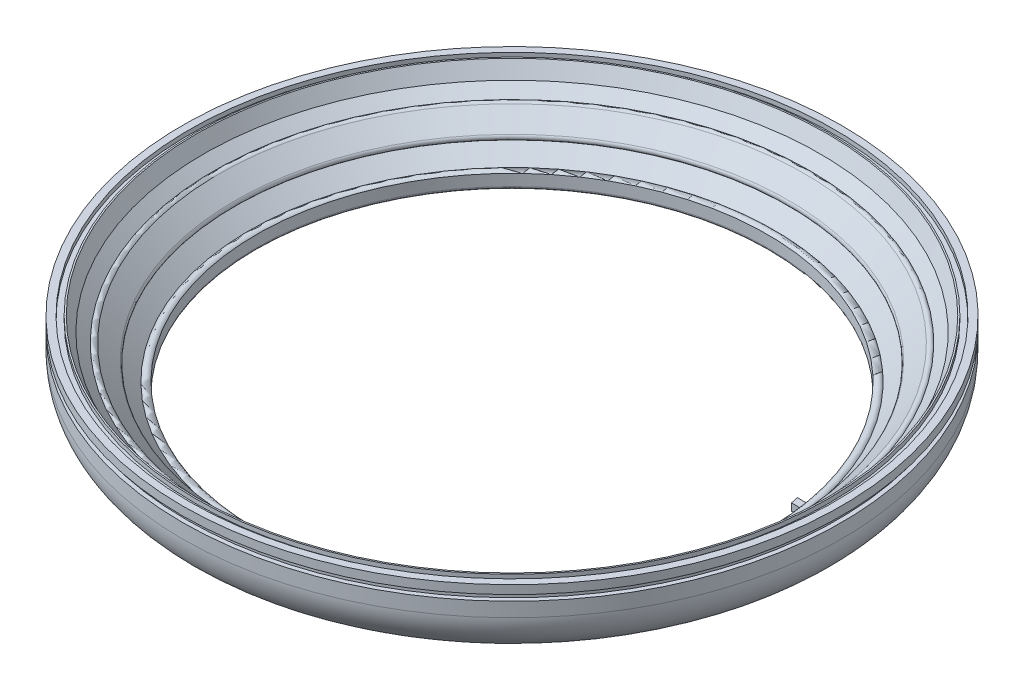
from build123d import *

# Parameters (mm, degrees)
FILLET1_R               = 3
FILLET2_R               = 0.2
SKETCH2_W               = 3.548736527
SKETCH2_H               = 0.52
BOSS_EXTRUDE2_DEPTH     = 0.5
CUT_EXTRUDE3_DEPTH      = 33.9212261
CUT_EXTRUDE3_DEPTH_BACK = 33.9212261


with BuildPart() as part:
    # Sketch1 → Revolve1 (revolve)
    with BuildSketch(Plane.XY, mode=Mode.PRIVATE) as revolve1_sk:
        with BuildLine():
            Line((-23.009126928, -0.003272675), (-23.009126928, 3.996727325))
            Line((-23.009126928, 3.996727325), (-22.709126928, 3.996727325))
            Line((-22.709126928, 3.996727325), (-22.709126928, 4.396727325))
            Line((-22.709126928, 4.396727325), (-23.009126928, 4.396727325))
            Line((-23.009126928, 4.396727325), (-23.009126928, 4.996727325))
            Line((-23.009126928, 4.996727325), (-22.511249778, 4.996727325))
            Line((-22.511249778, 4.996727325), (-22.511249778, 4.696727325))
            Line((-22.511249778, 4.696727325), (-22.112179085, 4.696727325))
            Line((-22.112179085, 4.696727325), (-22.112179085, 4.996727325))
            Line((-22.112179085, 4.996727325), (-22.007749371, 4.996727325))
            Line((-22.007749371, 4.996727325), (-21.533849604, 4.004044591))
            Line((-21.533849604, 4.004044591), (-20.822330132, 3.337775998))
            ThreePointArc((-20.822330132, 3.337775998), (-20.639987918, 3.413304615), (-20.457645705, 3.337775998))
            Line((-20.457645705, 3.337775998), (-19.336135346, 2.287590924))
            ThreePointArc((-19.336135346, 2.287590924), (-19.265410161, 2.116845225), (-19.336135346, 1.946099525))
            Line((-19.336135346, 1.946099525), (-18.322127642, 0.996580204))
            ThreePointArc((-18.322127642, 0.996580204), (-18.07439859, 1.104034043), (-17.826605775, 0.996727325))
            Line((-17.826605775, 0.996727325), (-17.826605775, -0.003272675))
            Line((-17.826605775, -0.003272675), (-23.009126928, -0.003272675))
        make_face()
    revolve(revolve1_sk.sketch.rotate(Axis((0, 2.809033385, 0), (0, -1, 0)), 270), axis=Axis((0, 2.809033385, 0), (0, -1, 0)))

    # Fillet1
    fillet1_edges = [part.edges().sort_by_distance(p)[0] for p in [
        (0, -0.003272675, -23.009126928),
    ]]
    fillet(fillet1_edges, radius=FILLET1_R)

    # Fillet2
    fillet2_edges = [part.edges().sort_by_distance(p)[0] for p in [
        (0, -0.003272675, -17.826605775),
    ]]
    fillet(fillet2_edges, radius=FILLET2_R)

    # Sketch2 → Boss-Extrude2 (add)
    with BuildSketch(Plane(origin=(0, 0, 0), x_dir=(1, 0, 0), z_dir=(0, 1, 0))):
        with Locations((17.741621397, 3.192708257)):
            Rectangle(SKETCH2_W, SKETCH2_H)
    extrude(amount=BOSS_EXTRUDE2_DEPTH)

    # Sketch6 → Cut-Extrude3 (cut, two sides: drawn at the far end of the back side and taken through both)
    with BuildSketch(Plane(origin=(0, 0, 0), x_dir=(1, 0, 0), z_dir=(0, 1, 0)).offset(-CUT_EXTRUDE3_DEPTH_BACK)):
        Polygon((15.967253133, 2.932708257), (16.583594091, 2.932708257), (16.469161512, 3.452708257), (15.967253133, 3.452708257), align=None)
    extrude(amount=CUT_EXTRUDE3_DEPTH + CUT_EXTRUDE3_DEPTH_BACK, mode=Mode.SUBTRACT)


solid = part.part
